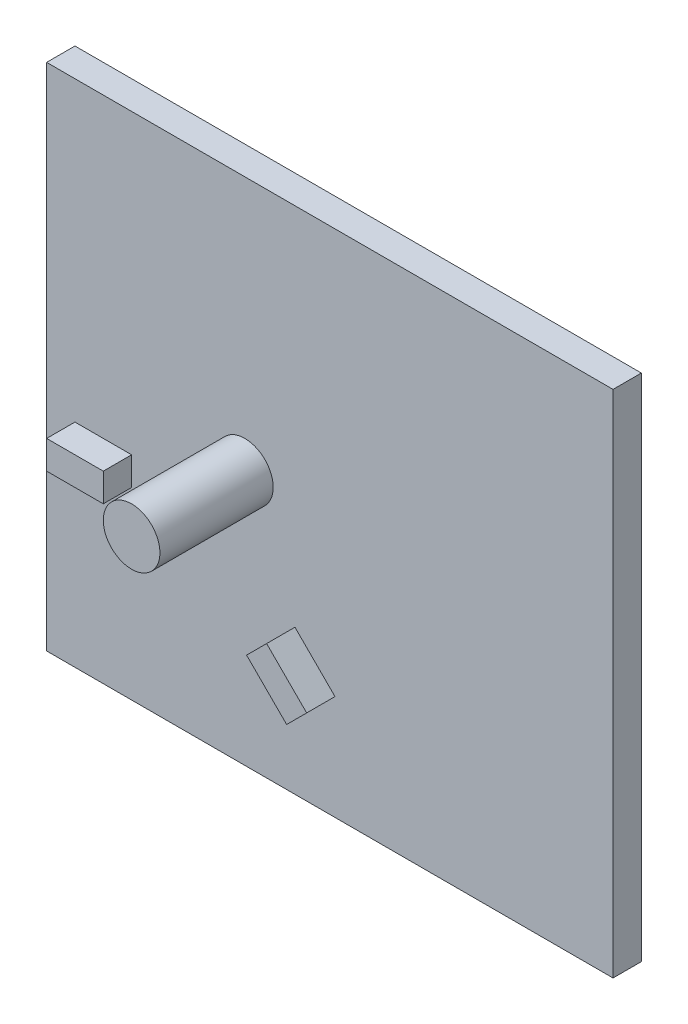
from build123d import *

# Parameters (mm, degrees)
ESQUISSE1_W        = 200
ESQUISSE1_H        = 180
ESQUISSE1_R        = 10
BOSS_EXTRU_1_DEPTH = 10
ESQUISSE3_R        = 10
BOSS_EXTRU_2_DEPTH = 50
ESQUISSE4_W        = 20
ESQUISSE4_H        = 10
BOSS_EXTRU_3_DEPTH = 10


with BuildPart() as part:
    # Esquisse1 → Boss.-Extru.1 (new body)
    with BuildSketch(Plane.XY):
        Rectangle(ESQUISSE1_W, ESQUISSE1_H)
        with Locations((-30, 0)):
            Circle(ESQUISSE1_R, mode=Mode.SUBTRACT)
    extrude(amount=BOSS_EXTRU_1_DEPTH)

    # Esquisse3 → Boss.-Extru.2 (add)
    with BuildSketch(Plane(origin=(0, 0, 0), x_dir=(-1, 0, 0), z_dir=(0, 0, -1))):
        with Locations((30, 0)):
            Circle(ESQUISSE3_R)
    extrude(amount=-BOSS_EXTRU_2_DEPTH)

    # Esquisse4 → Boss.-Extru.3 (add)
    with BuildSketch(Plane.XY.offset(10)):
        with Locations((-80, -20)):
            Rectangle(ESQUISSE4_W, ESQUISSE4_H)
        Polygon((-12.32233047, -38.890872965), (1.819805153, -53.033008589), (-5.251262658, -60.104076401), (-19.393398282, -45.961940777), align=None)
    extrude(amount=BOSS_EXTRU_3_DEPTH)


solid = part.part
